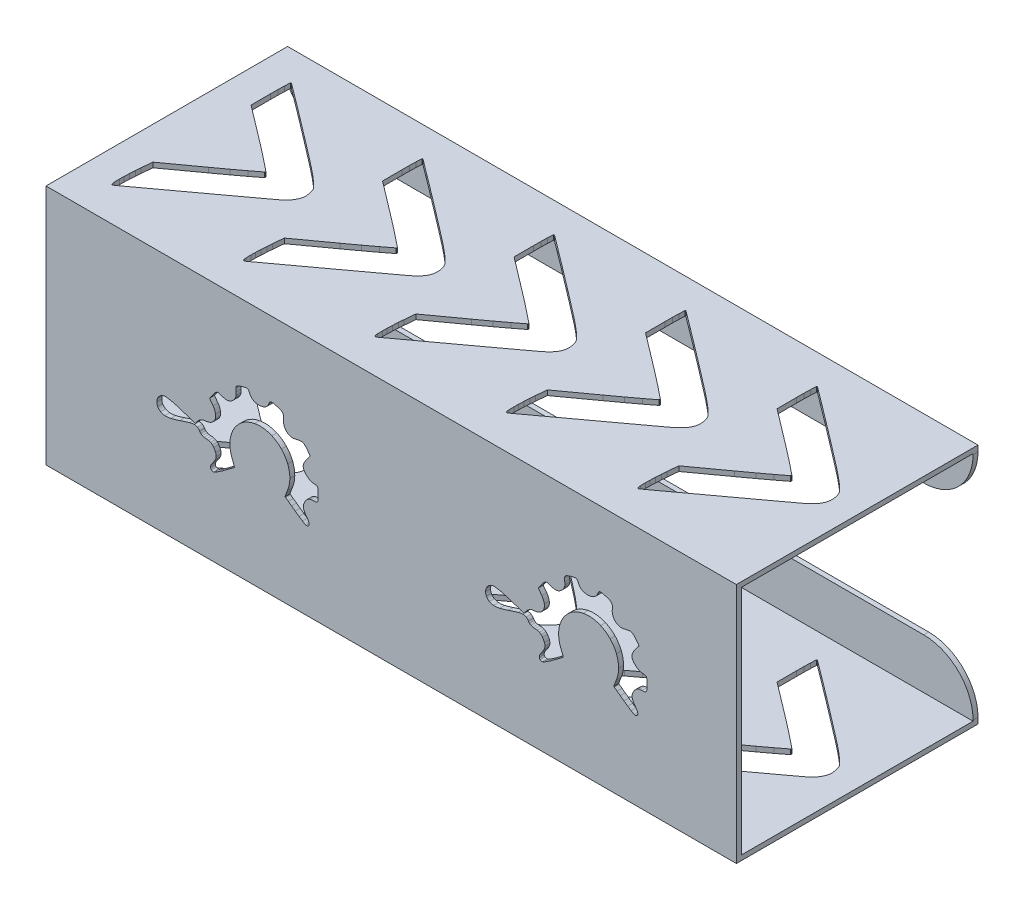
from build123d import *

# Parameters (mm, degrees)
SKETCH1_W           = 73.5
SKETCH1_H           = 73.5
BOSS_EXTRUDE1_DEPTH = 210
SHELL1_T            = -1.5
SKETCH2_W           = 210
SKETCH2_H           = 40
CUT_EXTRUDE1_DEPTH  = 72
FILLET1_R           = 15
CUT_EXTRUDE2_DEPTH  = 235.317092846
CUT_EXTRUDE3_DEPTH  = 235.317092846


with BuildPart() as part:
    # Sketch1 → Boss-Extrude1 (new body)
    with BuildSketch(Plane.YZ):
        with Locations((36.75, -36.75)):
            Rectangle(SKETCH1_W, SKETCH1_H)
    extrude(amount=BOSS_EXTRUDE1_DEPTH)

    # Shell1
    shell1_openings = [part.faces().sort_by_distance(p)[0] for p in [
        (210, 36.75, -36.75),
        (0, 36.75, -36.75),
    ]]
    offset(amount=SHELL1_T, openings=shell1_openings, kind=Kind.INTERSECTION)

    # Sketch2 → Cut-Extrude1 (cut)
    with BuildSketch(Plane(origin=(0, 0, -73.5), x_dir=(1, 0, 0), z_dir=(0, 0, -1))):
        with Locations((105, -36.75)):
            Rectangle(SKETCH2_W, SKETCH2_H)
    extrude(amount=-CUT_EXTRUDE1_DEPTH, mode=Mode.SUBTRACT)

    # Fillet1
    fillet1_edges = [part.edges().sort_by_distance(p)[0] for p in [
        (0, 56.75, -72.75),
        (0, 16.75, -72.75),
        (210, 16.75, -72.75),
        (210, 56.75, -72.75),
    ]]
    fillet(fillet1_edges, radius=FILLET1_R)

    # Sketch3 → Cut-Extrude2 (cut, through all)
    with BuildSketch(Plane.XZ):
        with BuildLine():
            Line((9.663257467, -19.228668253), (9.975836342, -22.536988138))
            Line((9.975836342, -22.536988138), (19.794289654, -29.64259699))
            ThreePointArc((19.794289654, -29.64259699), (21.680186944, -31.013445307), (23.560329366, -32.392175946))
            ThreePointArc((23.560329366, -32.392175946), (25.152200304, -33.572999566), (26.73601923, -34.764601478))
            ThreePointArc((26.73601923, -34.764601478), (28.127037125, -35.819882766), (29.516779226, -36.876843634))
            ThreePointArc((29.516779226, -36.876843634), (29.601580065, -36.975921835), (29.638093182, -37.101119538))
            ThreePointArc((29.638093182, -37.101119538), (29.616500804, -37.226977105), (29.538902118, -37.328391118))
            ThreePointArc((29.538902118, -37.328391118), (28.145149029, -38.444923087), (26.74997907, -39.55968409))
            ThreePointArc((26.74997907, -39.55968409), (25.160360253, -40.818728958), (23.561627814, -42.066180982))
            ThreePointArc((23.561627814, -42.066180982), (21.669255475, -43.524968693), (19.770389604, -44.97529385))
            Line((19.770389604, -44.97529385), (9.877794374, -52.496205334))
            Line((9.877794374, -52.496205334), (9.864618886, -58.465205334))
            ThreePointArc((9.864618886, -58.465205334), (9.866878883, -59.609623683), (9.878712838, -60.753983078))
            ThreePointArc((9.878712838, -60.753983078), (9.899425164, -61.717588304), (9.93356363, -62.68081133))
            ThreePointArc((9.93356363, -62.68081133), (9.970188655, -63.506317239), (10.010019657, -64.331674671))
            ThreePointArc((10.010019657, -64.331674671), (10.043438117, -64.404479774), (10.117827417, -64.434205327))
            ThreePointArc((10.117827417, -64.434205327), (10.220085544, -64.417623662), (10.311863958, -64.369577863))
            Line((10.311863958, -64.369577863), (14.816379874, -60.994539874))
            ThreePointArc((14.816379874, -60.994539874), (17.326887767, -59.107618199), (19.83253799, -57.214250762))
            ThreePointArc((19.83253799, -57.214250762), (22.787440363, -54.971790576), (25.738827422, -52.724705766))
            ThreePointArc((25.738827422, -52.724705766), (30.013178264, -49.453504747), (34.276329778, -46.167721674))
            ThreePointArc((34.276329778, -46.167721674), (36.389532688, -44.494924194), (38.464591658, -42.775038086))
            ThreePointArc((38.464591658, -42.775038086), (39.67538838, -41.705916753), (40.842428914, -40.589195874))
            ThreePointArc((40.842428914, -40.589195874), (41.384316671, -39.913892426), (41.763925166, -39.135705766))
            ThreePointArc((41.763925166, -39.135705766), (42.046538139, -38.092832108), (42.163637854, -37.018707714))
            ThreePointArc((42.163637854, -37.018707714), (42.091706427, -36.040632584), (41.819391654, -35.098480922))
            ThreePointArc((41.819391654, -35.098480922), (41.32598649, -34.140518072), (40.66857963, -33.286727878))
            ThreePointArc((40.66857963, -33.286727878), (39.706433503, -32.338963648), (38.660461726, -31.484607022))
            ThreePointArc((38.660461726, -31.484607022), (34.874262586, -28.679614228), (31.083552318, -25.880720846))
            ThreePointArc((31.083552318, -25.880720846), (26.166186357, -22.258918743), (21.246098192, -18.640815524))
            Line((21.246098192, -18.640815524), (10.73131159, -10.916203658))
            ThreePointArc((10.73131159, -10.916203658), (10.360052326, -10.655012395), (9.97844289, -10.409190194))
            ThreePointArc((9.97844289, -10.409190194), (9.83011461, -10.371570742), (9.686821934, -10.425270934))
            ThreePointArc((9.686821934, -10.425270934), (9.557626632, -10.566188974), (9.481675786, -10.741633522))
            ThreePointArc((9.481675786, -10.741633522), (9.407228217, -11.127679811), (9.372710265, -11.519320832))
            ThreePointArc((9.372710265, -11.519320832), (9.353024947, -12.244151425), (9.347054262, -12.969224698))
            ThreePointArc((9.347054262, -12.969224698), (9.353376442, -13.653172477), (9.370667626, -14.336930878))
            ThreePointArc((9.370667626, -14.336930878), (9.402423427, -15.181214679), (9.441426946, -16.02519471))
            ThreePointArc((9.441426946, -16.02519471), (9.488624469, -16.886465956), (9.543178838, -17.747302518))
            ThreePointArc((9.543178838, -17.747302518), (9.598284967, -18.488385266), (9.663257467, -19.228668253))
        make_face()
        with BuildLine():
            Line((49.663257467, -19.228668253), (49.975836342, -22.536988138))
            Line((49.975836342, -22.536988138), (59.794289654, -29.64259699))
            ThreePointArc((59.794289654, -29.64259699), (61.680186944, -31.013445307), (63.560329366, -32.392175946))
            ThreePointArc((63.560329366, -32.392175946), (65.152200304, -33.572999566), (66.73601923, -34.764601478))
            ThreePointArc((66.73601923, -34.764601478), (68.127037125, -35.819882766), (69.516779226, -36.876843634))
            ThreePointArc((69.516779226, -36.876843634), (69.601580065, -36.975921835), (69.638093182, -37.101119538))
            ThreePointArc((69.638093182, -37.101119538), (69.616500804, -37.226977105), (69.538902118, -37.328391118))
            ThreePointArc((69.538902118, -37.328391118), (68.145149029, -38.444923087), (66.74997907, -39.55968409))
            ThreePointArc((66.74997907, -39.55968409), (65.160360253, -40.818728958), (63.561627814, -42.066180982))
            ThreePointArc((63.561627814, -42.066180982), (61.669255475, -43.524968693), (59.770389604, -44.97529385))
            Line((59.770389604, -44.97529385), (49.877794374, -52.496205334))
            Line((49.877794374, -52.496205334), (49.864618886, -58.465205334))
            ThreePointArc((49.864618886, -58.465205334), (49.866878883, -59.609623683), (49.878712838, -60.753983078))
            ThreePointArc((49.878712838, -60.753983078), (49.899425164, -61.717588304), (49.93356363, -62.68081133))
            ThreePointArc((49.93356363, -62.68081133), (49.970188655, -63.506317239), (50.010019657, -64.331674671))
            ThreePointArc((50.010019657, -64.331674671), (50.043438117, -64.404479774), (50.117827417, -64.434205327))
            ThreePointArc((50.117827417, -64.434205327), (50.220085544, -64.417623662), (50.311863958, -64.369577863))
            Line((50.311863958, -64.369577863), (54.816379874, -60.994539874))
            ThreePointArc((54.816379874, -60.994539874), (57.326887767, -59.107618199), (59.83253799, -57.214250762))
            ThreePointArc((59.83253799, -57.214250762), (62.787440363, -54.971790576), (65.738827422, -52.724705766))
            ThreePointArc((65.738827422, -52.724705766), (70.013178264, -49.453504747), (74.276329778, -46.167721674))
            ThreePointArc((74.276329778, -46.167721674), (76.389532688, -44.494924194), (78.464591658, -42.775038086))
            ThreePointArc((78.464591658, -42.775038086), (79.67538838, -41.705916753), (80.842428914, -40.589195874))
            ThreePointArc((80.842428914, -40.589195874), (81.384316671, -39.913892426), (81.763925166, -39.135705766))
            ThreePointArc((81.763925166, -39.135705766), (82.046538139, -38.092832108), (82.163637854, -37.018707714))
            ThreePointArc((82.163637854, -37.018707714), (82.091706427, -36.040632584), (81.819391654, -35.098480922))
            ThreePointArc((81.819391654, -35.098480922), (81.32598649, -34.140518072), (80.66857963, -33.286727878))
            ThreePointArc((80.66857963, -33.286727878), (79.706433503, -32.338963648), (78.660461726, -31.484607022))
            ThreePointArc((78.660461726, -31.484607022), (74.874262586, -28.679614228), (71.083552318, -25.880720846))
            ThreePointArc((71.083552318, -25.880720846), (66.166186357, -22.258918743), (61.246098192, -18.640815524))
            Line((61.246098192, -18.640815524), (50.73131159, -10.916203658))
            ThreePointArc((50.73131159, -10.916203658), (50.360052326, -10.655012395), (49.97844289, -10.409190194))
            ThreePointArc((49.97844289, -10.409190194), (49.83011461, -10.371570742), (49.686821934, -10.425270934))
            ThreePointArc((49.686821934, -10.425270934), (49.557626632, -10.566188974), (49.481675786, -10.741633522))
            ThreePointArc((49.481675786, -10.741633522), (49.407228217, -11.127679811), (49.372710265, -11.519320832))
            ThreePointArc((49.372710265, -11.519320832), (49.353024947, -12.244151425), (49.347054262, -12.969224698))
            ThreePointArc((49.347054262, -12.969224698), (49.353376442, -13.653172477), (49.370667626, -14.336930878))
            ThreePointArc((49.370667626, -14.336930878), (49.402423427, -15.181214679), (49.441426946, -16.02519471))
            ThreePointArc((49.441426946, -16.02519471), (49.488624469, -16.886465956), (49.543178838, -17.747302518))
            ThreePointArc((49.543178838, -17.747302518), (49.598284967, -18.488385266), (49.663257467, -19.228668253))
        make_face()
        with BuildLine():
            Line((89.663257467, -19.228668253), (89.975836342, -22.536988138))
            Line((89.975836342, -22.536988138), (99.794289654, -29.64259699))
            ThreePointArc((99.794289654, -29.64259699), (101.680186944, -31.013445307), (103.560329366, -32.392175946))
            ThreePointArc((103.560329366, -32.392175946), (105.152200304, -33.572999566), (106.73601923, -34.764601478))
            ThreePointArc((106.73601923, -34.764601478), (108.127037125, -35.819882766), (109.516779226, -36.876843634))
            ThreePointArc((109.516779226, -36.876843634), (109.601580065, -36.975921835), (109.638093182, -37.101119538))
            ThreePointArc((109.638093182, -37.101119538), (109.616500804, -37.226977105), (109.538902118, -37.328391118))
            ThreePointArc((109.538902118, -37.328391118), (108.145149029, -38.444923087), (106.74997907, -39.55968409))
            ThreePointArc((106.74997907, -39.55968409), (105.160360253, -40.818728958), (103.561627814, -42.066180982))
            ThreePointArc((103.561627814, -42.066180982), (101.669255475, -43.524968693), (99.770389604, -44.97529385))
            Line((99.770389604, -44.97529385), (89.877794374, -52.496205334))
            Line((89.877794374, -52.496205334), (89.864618886, -58.465205334))
            ThreePointArc((89.864618886, -58.465205334), (89.866878883, -59.609623683), (89.878712838, -60.753983078))
            ThreePointArc((89.878712838, -60.753983078), (89.899425164, -61.717588304), (89.93356363, -62.68081133))
            ThreePointArc((89.93356363, -62.68081133), (89.970188655, -63.506317239), (90.010019657, -64.331674671))
            ThreePointArc((90.010019657, -64.331674671), (90.043438117, -64.404479774), (90.117827417, -64.434205327))
            ThreePointArc((90.117827417, -64.434205327), (90.220085544, -64.417623662), (90.311863958, -64.369577863))
            Line((90.311863958, -64.369577863), (94.816379874, -60.994539874))
            ThreePointArc((94.816379874, -60.994539874), (97.326887767, -59.107618199), (99.83253799, -57.214250762))
            ThreePointArc((99.83253799, -57.214250762), (102.787440363, -54.971790576), (105.738827422, -52.724705766))
            ThreePointArc((105.738827422, -52.724705766), (110.013178264, -49.453504747), (114.276329778, -46.167721674))
            ThreePointArc((114.276329778, -46.167721674), (116.389532688, -44.494924194), (118.464591658, -42.775038086))
            ThreePointArc((118.464591658, -42.775038086), (119.67538838, -41.705916753), (120.842428914, -40.589195874))
            ThreePointArc((120.842428914, -40.589195874), (121.384316671, -39.913892426), (121.763925166, -39.135705766))
            ThreePointArc((121.763925166, -39.135705766), (122.046538139, -38.092832108), (122.163637854, -37.018707714))
            ThreePointArc((122.163637854, -37.018707714), (122.091706427, -36.040632584), (121.819391654, -35.098480922))
            ThreePointArc((121.819391654, -35.098480922), (121.32598649, -34.140518072), (120.66857963, -33.286727878))
            ThreePointArc((120.66857963, -33.286727878), (119.706433503, -32.338963648), (118.660461726, -31.484607022))
            ThreePointArc((118.660461726, -31.484607022), (114.874262586, -28.679614228), (111.083552318, -25.880720846))
            ThreePointArc((111.083552318, -25.880720846), (106.166186357, -22.258918743), (101.246098192, -18.640815524))
            Line((101.246098192, -18.640815524), (90.73131159, -10.916203658))
            ThreePointArc((90.73131159, -10.916203658), (90.360052326, -10.655012395), (89.97844289, -10.409190194))
            ThreePointArc((89.97844289, -10.409190194), (89.83011461, -10.371570742), (89.686821934, -10.425270934))
            ThreePointArc((89.686821934, -10.425270934), (89.557626632, -10.566188974), (89.481675786, -10.741633522))
            ThreePointArc((89.481675786, -10.741633522), (89.407228217, -11.127679811), (89.372710265, -11.519320832))
            ThreePointArc((89.372710265, -11.519320832), (89.353024947, -12.244151425), (89.347054262, -12.969224698))
            ThreePointArc((89.347054262, -12.969224698), (89.353376442, -13.653172477), (89.370667626, -14.336930878))
            ThreePointArc((89.370667626, -14.336930878), (89.402423427, -15.181214679), (89.441426946, -16.02519471))
            ThreePointArc((89.441426946, -16.02519471), (89.488624469, -16.886465956), (89.543178838, -17.747302518))
            ThreePointArc((89.543178838, -17.747302518), (89.598284967, -18.488385266), (89.663257467, -19.228668253))
        make_face()
        with BuildLine():
            Line((129.663257467, -19.228668253), (129.975836342, -22.536988138))
            Line((129.975836342, -22.536988138), (139.794289654, -29.64259699))
            ThreePointArc((139.794289654, -29.64259699), (141.680186944, -31.013445307), (143.560329366, -32.392175946))
            ThreePointArc((143.560329366, -32.392175946), (145.152200304, -33.572999566), (146.73601923, -34.764601478))
            ThreePointArc((146.73601923, -34.764601478), (148.127037125, -35.819882766), (149.516779226, -36.876843634))
            ThreePointArc((149.516779226, -36.876843634), (149.601580065, -36.975921835), (149.638093182, -37.101119538))
            ThreePointArc((149.638093182, -37.101119538), (149.616500804, -37.226977105), (149.538902118, -37.328391118))
            ThreePointArc((149.538902118, -37.328391118), (148.145149029, -38.444923087), (146.74997907, -39.55968409))
            ThreePointArc((146.74997907, -39.55968409), (145.160360253, -40.818728958), (143.561627814, -42.066180982))
            ThreePointArc((143.561627814, -42.066180982), (141.669255475, -43.524968693), (139.770389604, -44.97529385))
            Line((139.770389604, -44.97529385), (129.877794374, -52.496205334))
            Line((129.877794374, -52.496205334), (129.864618886, -58.465205334))
            ThreePointArc((129.864618886, -58.465205334), (129.866878883, -59.609623683), (129.878712838, -60.753983078))
            ThreePointArc((129.878712838, -60.753983078), (129.899425164, -61.717588304), (129.93356363, -62.68081133))
            ThreePointArc((129.93356363, -62.68081133), (129.970188655, -63.506317239), (130.010019657, -64.331674671))
            ThreePointArc((130.010019657, -64.331674671), (130.043438117, -64.404479774), (130.117827417, -64.434205327))
            ThreePointArc((130.117827417, -64.434205327), (130.220085544, -64.417623662), (130.311863958, -64.369577863))
            Line((130.311863958, -64.369577863), (134.816379874, -60.994539874))
            ThreePointArc((134.816379874, -60.994539874), (137.326887767, -59.107618199), (139.83253799, -57.214250762))
            ThreePointArc((139.83253799, -57.214250762), (142.787440363, -54.971790576), (145.738827422, -52.724705766))
            ThreePointArc((145.738827422, -52.724705766), (150.013178264, -49.453504747), (154.276329778, -46.167721674))
            ThreePointArc((154.276329778, -46.167721674), (156.389532688, -44.494924194), (158.464591658, -42.775038086))
            ThreePointArc((158.464591658, -42.775038086), (159.67538838, -41.705916753), (160.842428914, -40.589195874))
            ThreePointArc((160.842428914, -40.589195874), (161.384316671, -39.913892426), (161.763925166, -39.135705766))
            ThreePointArc((161.763925166, -39.135705766), (162.046538139, -38.092832108), (162.163637854, -37.018707714))
            ThreePointArc((162.163637854, -37.018707714), (162.091706427, -36.040632584), (161.819391654, -35.098480922))
            ThreePointArc((161.819391654, -35.098480922), (161.32598649, -34.140518072), (160.66857963, -33.286727878))
            ThreePointArc((160.66857963, -33.286727878), (159.706433503, -32.338963648), (158.660461726, -31.484607022))
            ThreePointArc((158.660461726, -31.484607022), (154.874262586, -28.679614228), (151.083552318, -25.880720846))
            ThreePointArc((151.083552318, -25.880720846), (146.166186357, -22.258918743), (141.246098192, -18.640815524))
            Line((141.246098192, -18.640815524), (130.73131159, -10.916203658))
            ThreePointArc((130.73131159, -10.916203658), (130.360052326, -10.655012395), (129.97844289, -10.409190194))
            ThreePointArc((129.97844289, -10.409190194), (129.83011461, -10.371570742), (129.686821934, -10.425270934))
            ThreePointArc((129.686821934, -10.425270934), (129.557626632, -10.566188974), (129.481675786, -10.741633522))
            ThreePointArc((129.481675786, -10.741633522), (129.407228217, -11.127679811), (129.372710265, -11.519320832))
            ThreePointArc((129.372710265, -11.519320832), (129.353024947, -12.244151425), (129.347054262, -12.969224698))
            ThreePointArc((129.347054262, -12.969224698), (129.353376442, -13.653172477), (129.370667626, -14.336930878))
            ThreePointArc((129.370667626, -14.336930878), (129.402423427, -15.181214679), (129.441426946, -16.02519471))
            ThreePointArc((129.441426946, -16.02519471), (129.488624469, -16.886465956), (129.543178838, -17.747302518))
            ThreePointArc((129.543178838, -17.747302518), (129.598284967, -18.488385266), (129.663257467, -19.228668253))
        make_face()
        with BuildLine():
            Line((169.663257467, -19.228668253), (169.975836342, -22.536988138))
            Line((169.975836342, -22.536988138), (179.794289654, -29.64259699))
            ThreePointArc((179.794289654, -29.64259699), (181.680186944, -31.013445307), (183.560329366, -32.392175946))
            ThreePointArc((183.560329366, -32.392175946), (185.152200304, -33.572999566), (186.73601923, -34.764601478))
            ThreePointArc((186.73601923, -34.764601478), (188.127037125, -35.819882766), (189.516779226, -36.876843634))
            ThreePointArc((189.516779226, -36.876843634), (189.601580065, -36.975921835), (189.638093182, -37.101119538))
            ThreePointArc((189.638093182, -37.101119538), (189.616500804, -37.226977105), (189.538902118, -37.328391118))
            ThreePointArc((189.538902118, -37.328391118), (188.145149029, -38.444923087), (186.74997907, -39.55968409))
            ThreePointArc((186.74997907, -39.55968409), (185.160360253, -40.818728958), (183.561627814, -42.066180982))
            ThreePointArc((183.561627814, -42.066180982), (181.669255475, -43.524968693), (179.770389604, -44.97529385))
            Line((179.770389604, -44.97529385), (169.877794374, -52.496205334))
            Line((169.877794374, -52.496205334), (169.864618886, -58.465205334))
            ThreePointArc((169.864618886, -58.465205334), (169.866878883, -59.609623683), (169.878712838, -60.753983078))
            ThreePointArc((169.878712838, -60.753983078), (169.899425164, -61.717588304), (169.93356363, -62.68081133))
            ThreePointArc((169.93356363, -62.68081133), (169.970188655, -63.506317239), (170.010019657, -64.331674671))
            ThreePointArc((170.010019657, -64.331674671), (170.043438117, -64.404479774), (170.117827417, -64.434205327))
            ThreePointArc((170.117827417, -64.434205327), (170.220085544, -64.417623662), (170.311863958, -64.369577863))
            Line((170.311863958, -64.369577863), (174.816379874, -60.994539874))
            ThreePointArc((174.816379874, -60.994539874), (177.326887767, -59.107618199), (179.83253799, -57.214250762))
            ThreePointArc((179.83253799, -57.214250762), (182.787440363, -54.971790576), (185.738827422, -52.724705766))
            ThreePointArc((185.738827422, -52.724705766), (190.013178264, -49.453504747), (194.276329778, -46.167721674))
            ThreePointArc((194.276329778, -46.167721674), (196.389532688, -44.494924194), (198.464591658, -42.775038086))
            ThreePointArc((198.464591658, -42.775038086), (199.67538838, -41.705916753), (200.842428914, -40.589195874))
            ThreePointArc((200.842428914, -40.589195874), (201.384316671, -39.913892426), (201.763925166, -39.135705766))
            ThreePointArc((201.763925166, -39.135705766), (202.046538139, -38.092832108), (202.163637854, -37.018707714))
            ThreePointArc((202.163637854, -37.018707714), (202.091706427, -36.040632584), (201.819391654, -35.098480922))
            ThreePointArc((201.819391654, -35.098480922), (201.32598649, -34.140518072), (200.66857963, -33.286727878))
            ThreePointArc((200.66857963, -33.286727878), (199.706433503, -32.338963648), (198.660461726, -31.484607022))
            ThreePointArc((198.660461726, -31.484607022), (194.874262586, -28.679614228), (191.083552318, -25.880720846))
            ThreePointArc((191.083552318, -25.880720846), (186.166186357, -22.258918743), (181.246098192, -18.640815524))
            Line((181.246098192, -18.640815524), (170.73131159, -10.916203658))
            ThreePointArc((170.73131159, -10.916203658), (170.360052326, -10.655012395), (169.97844289, -10.409190194))
            ThreePointArc((169.97844289, -10.409190194), (169.83011461, -10.371570742), (169.686821934, -10.425270934))
            ThreePointArc((169.686821934, -10.425270934), (169.557626632, -10.566188974), (169.481675786, -10.741633522))
            ThreePointArc((169.481675786, -10.741633522), (169.407228217, -11.127679811), (169.372710265, -11.519320832))
            ThreePointArc((169.372710265, -11.519320832), (169.353024947, -12.244151425), (169.347054262, -12.969224698))
            ThreePointArc((169.347054262, -12.969224698), (169.353376442, -13.653172477), (169.370667626, -14.336930878))
            ThreePointArc((169.370667626, -14.336930878), (169.402423427, -15.181214679), (169.441426946, -16.02519471))
            ThreePointArc((169.441426946, -16.02519471), (169.488624469, -16.886465956), (169.543178838, -17.747302518))
            ThreePointArc((169.543178838, -17.747302518), (169.598284967, -18.488385266), (169.663257467, -19.228668253))
        make_face()
    extrude(amount=-CUT_EXTRUDE2_DEPTH, mode=Mode.SUBTRACT)

    # Sketch7 → Cut-Extrude3 (cut, through all)
    with BuildSketch(Plane(origin=(0, 0, 0), x_dir=(-1, 0, 0), z_dir=(0, 0, 1))):
        with BuildLine():
            Line((-179.321663234, -41.14088793), (-180.406501868, -42.520035924))
            Line((-180.406501868, -42.520035924), (-179.377241544, -43.876391352))
            ThreePointArc((-179.377241544, -43.876391352), (-179.030776284, -44.298503593), (-178.653140376, -44.692975444))
            ThreePointArc((-178.653140376, -44.692975444), (-178.373869296, -44.896663015), (-178.049447908, -45.015959812))
            ThreePointArc((-178.049447908, -45.015959812), (-177.64930214, -45.062445672), (-177.247753804, -45.030250868))
            ThreePointArc((-177.247753804, -45.030250868), (-176.431305736, -44.871857402), (-175.619535064, -44.691014056))
            ThreePointArc((-175.619535064, -44.691014056), (-174.951483062, -44.624789984), (-174.28978258, -44.73806654))
            ThreePointArc((-174.28978258, -44.73806654), (-173.659117444, -45.024360836), (-173.11665564, -45.454986112))
            ThreePointArc((-173.11665564, -45.454986112), (-172.676458207, -46.021218643), (-172.379019828, -46.673846768))
            ThreePointArc((-172.379019828, -46.673846768), (-172.23775788, -47.382184055), (-172.260532892, -48.104110608))
            ThreePointArc((-172.260532892, -48.104110608), (-172.298158921, -48.614976609), (-172.261870964, -49.1259394))
            ThreePointArc((-172.261870964, -49.1259394), (-172.145170809, -49.492101984), (-171.915853876, -49.80049736))
            ThreePointArc((-171.915853876, -49.80049736), (-171.539809671, -50.089980039), (-171.10968226, -50.290479108))
            ThreePointArc((-171.10968226, -50.290479108), (-170.314322929, -50.539378064), (-169.508370248, -50.751480472))
            ThreePointArc((-169.508370248, -50.751480472), (-169.155085532, -50.823211001), (-168.797739208, -50.870739568))
            ThreePointArc((-168.797739208, -50.870739568), (-168.570451639, -50.864574921), (-168.351792424, -50.802238816))
            ThreePointArc((-168.351792424, -50.802238816), (-168.178939432, -50.694531215), (-168.046943656, -50.539430604))
            ThreePointArc((-168.046943656, -50.539430604), (-167.914562339, -50.291229489), (-167.813308868, -50.028786464))
            ThreePointArc((-167.813308868, -50.028786464), (-167.413552129, -49.272079461), (-166.774345236, -48.703022796))
            ThreePointArc((-166.774345236, -48.703022796), (-165.89579108, -48.308819341), (-164.946386992, -48.147929164))
            ThreePointArc((-164.946386992, -48.147929164), (-163.99424549, -48.231400994), (-163.09450398, -48.55390092))
            ThreePointArc((-163.09450398, -48.55390092), (-162.425551912, -49.06909097), (-161.986344652, -49.790211376))
            ThreePointArc((-161.986344652, -49.790211376), (-161.842429133, -50.12629544), (-161.67129626, -50.44937084))
            ThreePointArc((-161.67129626, -50.44937084), (-161.529159296, -50.619826597), (-161.339074928, -50.734395416))
            ThreePointArc((-161.339074928, -50.734395416), (-161.104159512, -50.791209612), (-160.862661352, -50.781631288))
            ThreePointArc((-160.862661352, -50.781631288), (-160.423186432, -50.690985625), (-159.988858172, -50.57823012))
            ThreePointArc((-159.988858172, -50.57823012), (-159.263615434, -50.356933764), (-158.546245868, -50.11131208))
            ThreePointArc((-158.546245868, -50.11131208), (-158.225531321, -49.947675985), (-157.955295056, -49.709753828))
            ThreePointArc((-157.955295056, -49.709753828), (-157.793338193, -49.444438529), (-157.73266304, -49.13957666))
            ThreePointArc((-157.73266304, -49.13957666), (-157.743582629, -48.618128784), (-157.797795752, -48.099391796))
            ThreePointArc((-157.797795752, -48.099391796), (-157.834085938, -47.724472779), (-157.833343052, -47.34780224))
            ThreePointArc((-157.833343052, -47.34780224), (-157.79290114, -47.015345334), (-157.706563016, -46.691757832))
            ThreePointArc((-157.706563016, -46.691757832), (-157.574572741, -46.378754676), (-157.401085344, -46.0867024))
            ThreePointArc((-157.401085344, -46.0867024), (-157.164795796, -45.775697666), (-156.90137946, -45.48730812))
            ThreePointArc((-156.90137946, -45.48730812), (-156.50785057, -45.147273763), (-156.069154048, -44.867928612))
            ThreePointArc((-156.069154048, -44.867928612), (-155.645411476, -44.694722751), (-155.194680308, -44.614726172))
            ThreePointArc((-155.194680308, -44.614726172), (-154.667320837, -44.622724803), (-154.14884496, -44.719444784))
            ThreePointArc((-154.14884496, -44.719444784), (-153.450246306, -44.936932481), (-152.767381632, -45.19968106))
            ThreePointArc((-152.767381632, -45.19968106), (-152.550284586, -45.259486296), (-152.325105148, -45.260905728))
            ThreePointArc((-152.325105148, -45.260905728), (-152.090222101, -45.205422966), (-151.872482228, -45.101318544))
            ThreePointArc((-151.872482228, -45.101318544), (-151.614763794, -44.915462652), (-151.38629016, -44.694643716))
            ThreePointArc((-151.38629016, -44.694643716), (-151.102196964, -44.359184204), (-150.837302265, -44.008366835))
            Line((-150.837302265, -44.008366835), (-149.738653628, -42.465456912))
            Line((-149.738653628, -42.465456912), (-150.8111732, -41.014796872))
            ThreePointArc((-150.8111732, -41.014796872), (-151.297962451, -40.166639094), (-151.577441416, -39.229501484))
            ThreePointArc((-151.577441416, -39.229501484), (-151.591472145, -38.351362841), (-151.331492708, -37.512473676))
            ThreePointArc((-151.331492708, -37.512473676), (-150.825298047, -36.801244644), (-150.121303104, -36.285036456))
            ThreePointArc((-150.121303104, -36.285036456), (-149.213717078, -35.948907246), (-148.252643392, -35.83474678))
            ThreePointArc((-148.252643392, -35.83474678), (-148.007727184, -35.814899021), (-147.769202652, -35.755874192))
            ThreePointArc((-147.769202652, -35.755874192), (-147.489500491, -35.647905142), (-147.220620056, -35.51526304))
            ThreePointArc((-147.220620056, -35.51526304), (-146.950104223, -35.350683443), (-146.694850724, -35.163304384))
            ThreePointArc((-146.694850724, -35.163304384), (-146.474797857, -34.96638826), (-146.276985268, -34.747140902))
            Line((-146.276985268, -34.747140902), (-145.396298584, -33.659538024))
            Line((-145.396298584, -33.659538024), (-141.21969378, -35.050475044))
            ThreePointArc((-141.21969378, -35.050475044), (-140.313656804, -35.340049355), (-139.400860232, -35.60755394))
            ThreePointArc((-139.400860232, -35.60755394), (-138.616256284, -35.810750314), (-137.824314744, -35.983147296))
            ThreePointArc((-137.824314744, -35.983147296), (-137.190742508, -36.093999256), (-136.552973624, -36.17738262))
            ThreePointArc((-136.552973624, -36.17738262), (-136.163458011, -36.185106029), (-135.778677484, -36.124064972))
            ThreePointArc((-135.778677484, -36.124064972), (-135.222677367, -35.915581029), (-134.727428888, -35.587967492))
            ThreePointArc((-134.727428888, -35.587967492), (-134.305584812, -35.151126578), (-133.984685136, -34.635562996))
            ThreePointArc((-133.984685136, -34.635562996), (-133.785521525, -34.076622475), (-133.711786012, -33.4878579))
            ThreePointArc((-133.711786012, -33.4878579), (-133.774229316, -32.927863497), (-133.975155056, -32.401439956))
            ThreePointArc((-133.975155056, -32.401439956), (-134.354221473, -31.878675628), (-134.859788288, -31.476959204))
            ThreePointArc((-134.859788288, -31.476959204), (-135.476174387, -31.205114337), (-136.13952868, -31.087672708))
            ThreePointArc((-136.13952868, -31.087672708), (-137.069837646, -31.104178948), (-137.987879568, -31.255659164))
            ThreePointArc((-137.987879568, -31.255659164), (-139.33592604, -31.613229815), (-140.666224732, -32.032027436))
            ThreePointArc((-140.666224732, -32.032027436), (-142.129356617, -32.514166999), (-143.601410596, -32.968337178))
            ThreePointArc((-143.601410596, -32.968337178), (-144.354648103, -33.142676748), (-145.12371032, -33.222076574))
            ThreePointArc((-145.12371032, -33.222076574), (-145.609158337, -33.172108568), (-146.060730036, -32.98706917))
            ThreePointArc((-146.060730036, -32.98706917), (-146.449539983, -32.679730661), (-146.740817576, -32.278747498))
            ThreePointArc((-146.740817576, -32.278747498), (-146.888434914, -32.048587385), (-147.07038156, -31.844479634))
            ThreePointArc((-147.07038156, -31.844479634), (-147.285457349, -31.667208024), (-147.524469044, -31.52383359))
            ThreePointArc((-147.524469044, -31.52383359), (-147.802501934, -31.406842559), (-148.093753656, -31.328346554))
            ThreePointArc((-148.093753656, -31.328346554), (-148.426213212, -31.279186483), (-148.761885416, -31.262747498))
            ThreePointArc((-148.761885416, -31.262747498), (-149.104425315, -31.244220548), (-149.442968636, -31.18885585))
            ThreePointArc((-149.442968636, -31.18885585), (-149.759008037, -31.098808087), (-150.061628816, -30.970705918))
            ThreePointArc((-150.061628816, -30.970705918), (-150.340177074, -30.809429542), (-150.59626732, -30.61445009))
            ThreePointArc((-150.59626732, -30.61445009), (-150.82794629, -30.387441604), (-151.030011944, -30.13371445))
            ThreePointArc((-151.030011944, -30.13371445), (-151.352755861, -29.611947847), (-151.613988932, -29.056825062))
            ThreePointArc((-151.613988932, -29.056825062), (-151.744976464, -28.586248857), (-151.76884562, -28.098365714))
            ThreePointArc((-151.76884562, -28.098365714), (-151.684539035, -27.598219932), (-151.49822132, -27.126479418))
            ThreePointArc((-151.49822132, -27.126479418), (-151.161141853, -26.54743872), (-150.771805196, -26.002161118))
            ThreePointArc((-150.771805196, -26.002161118), (-150.460663883, -25.561754374), (-150.196406804, -25.091716914))
            ThreePointArc((-150.196406804, -25.091716914), (-150.069650473, -24.722031309), (-150.042505156, -24.332162426))
            ThreePointArc((-150.042505156, -24.332162426), (-150.121889054, -24.056419416), (-150.31091356, -23.840535774))
            ThreePointArc((-150.31091356, -23.840535774), (-150.597513215, -23.693450639), (-150.91563676, -23.642747498))
            ThreePointArc((-150.91563676, -23.642747498), (-151.093680104, -23.66608754), (-151.259691444, -23.734530398))
            ThreePointArc((-151.259691444, -23.734530398), (-151.704468574, -23.995205217), (-152.144627952, -24.263603762))
            ThreePointArc((-152.144627952, -24.263603762), (-152.669454186, -24.598833402), (-153.186003568, -24.94668139))
            ThreePointArc((-153.186003568, -24.94668139), (-153.750430306, -25.344087543), (-154.307862412, -25.751246773))
            Line((-154.307862412, -25.751246773), (-155.412927771, -26.573234689))
            Line((-155.412927771, -26.573234689), (-156.359785923, -27.276742045))
            Line((-156.359785923, -27.276742045), (-157.186206927, -27.890226721))
            ThreePointArc((-157.186206927, -27.890226721), (-157.237130479, -27.92756315), (-157.288486631, -27.964302265))
            ThreePointArc((-157.288486631, -27.964302265), (-157.318856704, -28.00481079), (-157.319800259, -28.055430861))
            ThreePointArc((-157.319800259, -28.055430861), (-157.239963839, -28.313900067), (-157.157093447, -28.571412557))
            ThreePointArc((-157.157093447, -28.571412557), (-157.051543805, -28.88021028), (-156.938533051, -29.186356209))
            ThreePointArc((-156.938533051, -29.186356209), (-156.798682262, -29.543463885), (-156.653486631, -29.898432001))
            ThreePointArc((-156.653486631, -29.898432001), (-155.980759026, -32.553929173), (-156.110055155, -35.290260689))
            ThreePointArc((-156.110055155, -35.290260689), (-157.02964926, -37.878846906), (-158.657532407, -40.091634373))
            ThreePointArc((-158.657532407, -40.091634373), (-160.8371487, -41.71908898), (-163.397987239, -42.636390269))
            ThreePointArc((-163.397987239, -42.636390269), (-166.089654917, -42.750397892), (-168.690720875, -42.048594137))
            ThreePointArc((-168.690720875, -42.048594137), (-170.244502811, -41.171718628), (-171.599344471, -40.010877105))
            ThreePointArc((-171.599344471, -40.010877105), (-172.706377125, -38.608259589), (-173.522614691, -37.018727133))
            ThreePointArc((-173.522614691, -37.018727133), (-174.018467074, -35.299527883), (-174.174599671, -33.517075005))
            ThreePointArc((-174.174599671, -33.517075005), (-173.985308479, -31.73718094), (-173.457766967, -30.026755849))
            ThreePointArc((-173.457766967, -30.026755849), (-173.302285272, -29.647150101), (-173.152159755, -29.265394405))
            ThreePointArc((-173.152159755, -29.265394405), (-173.030486826, -28.93842692), (-172.916292815, -28.608772909))
            ThreePointArc((-172.916292815, -28.608772909), (-172.825743196, -28.332637261), (-172.738075747, -28.055573101))
            ThreePointArc((-172.738075747, -28.055573101), (-172.738668473, -28.004342376), (-172.769149599, -27.963161805))
            ThreePointArc((-172.769149599, -27.963161805), (-172.820880431, -27.926003358), (-172.872453892, -27.888626798))
            Line((-172.872453892, -27.888626798), (-173.715224928, -27.275131692))
            Line((-173.715224928, -27.275131692), (-174.68118134, -26.571742192))
            Line((-174.68118134, -26.571742192), (-175.80212652, -25.75516064))
            ThreePointArc((-175.80212652, -25.75516064), (-176.372572608, -25.34615842), (-176.949188488, -24.9459014))
            ThreePointArc((-176.949188488, -24.9459014), (-177.469192929, -24.598941634), (-177.996553424, -24.263268272))
            ThreePointArc((-177.996553424, -24.263268272), (-178.439642357, -23.992281994), (-178.886570948, -23.727676252))
            ThreePointArc((-178.886570948, -23.727676252), (-179.038226913, -23.664352681), (-179.201145884, -23.64274678))
            ThreePointArc((-179.201145884, -23.64274678), (-179.502725296, -23.694947567), (-179.769213836, -23.845476372))
            ThreePointArc((-179.769213836, -23.845476372), (-179.946080245, -24.067401792), (-180.015798052, -24.342487316))
            ThreePointArc((-180.015798052, -24.342487316), (-179.981271707, -24.734093411), (-179.85181362, -25.10529148))
            ThreePointArc((-179.85181362, -25.10529148), (-179.592064418, -25.568393393), (-179.2858305, -26.0021604))
            ThreePointArc((-179.2858305, -26.0021604), (-178.896493843, -26.547438003), (-178.559414376, -27.1264787))
            ThreePointArc((-178.559414376, -27.1264787), (-178.373096662, -27.598219214), (-178.288790076, -28.098364996))
            ThreePointArc((-178.288790076, -28.098364996), (-178.312659233, -28.586248139), (-178.443646764, -29.056824344))
            ThreePointArc((-178.443646764, -29.056824344), (-178.704879836, -29.611947129), (-179.027623752, -30.133713732))
            ThreePointArc((-179.027623752, -30.133713732), (-179.230724407, -30.388730599), (-179.46359748, -30.6168832))
            ThreePointArc((-179.46359748, -30.6168832), (-179.720147834, -30.811873632), (-179.999399304, -30.972677764))
            ThreePointArc((-179.999399304, -30.972677764), (-180.303986772, -31.100334951), (-180.622002072, -31.189420028))
            ThreePointArc((-180.622002072, -31.189420028), (-180.965874776, -31.244364003), (-181.313623752, -31.26274678))
            ThreePointArc((-181.313623752, -31.26274678), (-181.760842754, -31.279778063), (-182.205471092, -31.330773568))
            ThreePointArc((-182.205471092, -31.330773568), (-182.429066517, -31.415468381), (-182.598751992, -31.58391708))
            ThreePointArc((-182.598751992, -31.58391708), (-182.722424943, -31.842171863), (-182.774074984, -32.123814908))
            ThreePointArc((-182.774074984, -32.123814908), (-182.8001308, -32.836069102), (-182.80881812, -33.54874678))
            ThreePointArc((-182.80881812, -33.54874678), (-182.800171423, -34.229657654), (-182.774236528, -34.910129376))
            ThreePointArc((-182.774236528, -34.910129376), (-182.725346818, -35.203974371), (-182.611262508, -35.47914678))
            ThreePointArc((-182.611262508, -35.47914678), (-182.460909076, -35.652513293), (-182.253451977, -35.750613519))
            ThreePointArc((-182.253451977, -35.750613519), (-181.898602759, -35.813641053), (-181.53881812, -35.83474678))
            ThreePointArc((-181.53881812, -35.83474678), (-180.968292282, -35.898224945), (-180.425671756, -36.085554))
            ThreePointArc((-180.425671756, -36.085554), (-179.849820086, -36.412171281), (-179.327382868, -36.818795612))
            ThreePointArc((-179.327382868, -36.818795612), (-178.883531887, -37.283871019), (-178.513790388, -37.809789312))
            ThreePointArc((-178.513790388, -37.809789312), (-178.307329668, -38.293270177), (-178.23681812, -38.814238408))
            ThreePointArc((-178.23681812, -38.814238408), (-178.255464783, -39.046656081), (-178.3109277, -39.273128016))
            ThreePointArc((-178.3109277, -39.273128016), (-178.4242778, -39.584378799), (-178.555490584, -39.8885309))
            ThreePointArc((-178.555490584, -39.8885309), (-178.721845692, -40.220790567), (-178.906465752, -40.54325908))
            ThreePointArc((-178.906465752, -40.54325908), (-179.105197704, -40.84823363), (-179.321663234, -41.14088793))
        make_face()
        with BuildLine():
            Line((-79.321663234, -41.14088793), (-80.406501868, -42.520035924))
            Line((-80.406501868, -42.520035924), (-79.377241544, -43.876391352))
            ThreePointArc((-79.377241544, -43.876391352), (-79.030776284, -44.298503593), (-78.653140376, -44.692975444))
            ThreePointArc((-78.653140376, -44.692975444), (-78.373869296, -44.896663015), (-78.049447908, -45.015959812))
            ThreePointArc((-78.049447908, -45.015959812), (-77.64930214, -45.062445672), (-77.247753804, -45.030250868))
            ThreePointArc((-77.247753804, -45.030250868), (-76.431305736, -44.871857402), (-75.619535064, -44.691014056))
            ThreePointArc((-75.619535064, -44.691014056), (-74.951483062, -44.624789984), (-74.28978258, -44.73806654))
            ThreePointArc((-74.28978258, -44.73806654), (-73.659117444, -45.024360836), (-73.11665564, -45.454986112))
            ThreePointArc((-73.11665564, -45.454986112), (-72.676458207, -46.021218643), (-72.379019828, -46.673846768))
            ThreePointArc((-72.379019828, -46.673846768), (-72.23775788, -47.382184055), (-72.260532892, -48.104110608))
            ThreePointArc((-72.260532892, -48.104110608), (-72.298158921, -48.614976609), (-72.261870964, -49.1259394))
            ThreePointArc((-72.261870964, -49.1259394), (-72.145170809, -49.492101984), (-71.915853876, -49.80049736))
            ThreePointArc((-71.915853876, -49.80049736), (-71.539809671, -50.089980039), (-71.10968226, -50.290479108))
            ThreePointArc((-71.10968226, -50.290479108), (-70.314322929, -50.539378064), (-69.508370248, -50.751480472))
            ThreePointArc((-69.508370248, -50.751480472), (-69.155085532, -50.823211001), (-68.797739208, -50.870739568))
            ThreePointArc((-68.797739208, -50.870739568), (-68.570451639, -50.864574921), (-68.351792424, -50.802238816))
            ThreePointArc((-68.351792424, -50.802238816), (-68.178939432, -50.694531215), (-68.046943656, -50.539430604))
            ThreePointArc((-68.046943656, -50.539430604), (-67.914562339, -50.291229489), (-67.813308868, -50.028786464))
            ThreePointArc((-67.813308868, -50.028786464), (-67.413552129, -49.272079461), (-66.774345236, -48.703022796))
            ThreePointArc((-66.774345236, -48.703022796), (-65.89579108, -48.308819341), (-64.946386992, -48.147929164))
            ThreePointArc((-64.946386992, -48.147929164), (-63.99424549, -48.231400994), (-63.09450398, -48.55390092))
            ThreePointArc((-63.09450398, -48.55390092), (-62.425551912, -49.06909097), (-61.986344652, -49.790211376))
            ThreePointArc((-61.986344652, -49.790211376), (-61.842429133, -50.12629544), (-61.67129626, -50.44937084))
            ThreePointArc((-61.67129626, -50.44937084), (-61.529159296, -50.619826597), (-61.339074928, -50.734395416))
            ThreePointArc((-61.339074928, -50.734395416), (-61.104159512, -50.791209612), (-60.862661352, -50.781631288))
            ThreePointArc((-60.862661352, -50.781631288), (-60.423186432, -50.690985625), (-59.988858172, -50.57823012))
            ThreePointArc((-59.988858172, -50.57823012), (-59.263615434, -50.356933764), (-58.546245868, -50.11131208))
            ThreePointArc((-58.546245868, -50.11131208), (-58.225531321, -49.947675985), (-57.955295056, -49.709753828))
            ThreePointArc((-57.955295056, -49.709753828), (-57.793338193, -49.444438529), (-57.73266304, -49.13957666))
            ThreePointArc((-57.73266304, -49.13957666), (-57.743582629, -48.618128784), (-57.797795752, -48.099391796))
            ThreePointArc((-57.797795752, -48.099391796), (-57.834085938, -47.724472779), (-57.833343052, -47.34780224))
            ThreePointArc((-57.833343052, -47.34780224), (-57.79290114, -47.015345334), (-57.706563016, -46.691757832))
            ThreePointArc((-57.706563016, -46.691757832), (-57.574572741, -46.378754676), (-57.401085344, -46.0867024))
            ThreePointArc((-57.401085344, -46.0867024), (-57.164795796, -45.775697666), (-56.90137946, -45.48730812))
            ThreePointArc((-56.90137946, -45.48730812), (-56.50785057, -45.147273763), (-56.069154048, -44.867928612))
            ThreePointArc((-56.069154048, -44.867928612), (-55.645411476, -44.694722751), (-55.194680308, -44.614726172))
            ThreePointArc((-55.194680308, -44.614726172), (-54.667320837, -44.622724803), (-54.14884496, -44.719444784))
            ThreePointArc((-54.14884496, -44.719444784), (-53.450246306, -44.936932481), (-52.767381632, -45.19968106))
            ThreePointArc((-52.767381632, -45.19968106), (-52.550284586, -45.259486296), (-52.325105148, -45.260905728))
            ThreePointArc((-52.325105148, -45.260905728), (-52.090222101, -45.205422966), (-51.872482228, -45.101318544))
            ThreePointArc((-51.872482228, -45.101318544), (-51.614763794, -44.915462652), (-51.38629016, -44.694643716))
            ThreePointArc((-51.38629016, -44.694643716), (-51.102196964, -44.359184204), (-50.837302265, -44.008366835))
            Line((-50.837302265, -44.008366835), (-49.738653628, -42.465456912))
            Line((-49.738653628, -42.465456912), (-50.8111732, -41.014796872))
            ThreePointArc((-50.8111732, -41.014796872), (-51.297962451, -40.166639094), (-51.577441416, -39.229501484))
            ThreePointArc((-51.577441416, -39.229501484), (-51.591472145, -38.351362841), (-51.331492708, -37.512473676))
            ThreePointArc((-51.331492708, -37.512473676), (-50.825298047, -36.801244644), (-50.121303104, -36.285036456))
            ThreePointArc((-50.121303104, -36.285036456), (-49.213717078, -35.948907246), (-48.252643392, -35.83474678))
            ThreePointArc((-48.252643392, -35.83474678), (-48.007727184, -35.814899021), (-47.769202652, -35.755874192))
            ThreePointArc((-47.769202652, -35.755874192), (-47.489500491, -35.647905142), (-47.220620056, -35.51526304))
            ThreePointArc((-47.220620056, -35.51526304), (-46.950104223, -35.350683443), (-46.694850724, -35.163304384))
            ThreePointArc((-46.694850724, -35.163304384), (-46.474797857, -34.96638826), (-46.276985268, -34.747140902))
            Line((-46.276985268, -34.747140902), (-45.396298584, -33.659538024))
            Line((-45.396298584, -33.659538024), (-41.21969378, -35.050475044))
            ThreePointArc((-41.21969378, -35.050475044), (-40.313656804, -35.340049355), (-39.400860232, -35.60755394))
            ThreePointArc((-39.400860232, -35.60755394), (-38.616256284, -35.810750314), (-37.824314744, -35.983147296))
            ThreePointArc((-37.824314744, -35.983147296), (-37.190742508, -36.093999256), (-36.552973624, -36.17738262))
            ThreePointArc((-36.552973624, -36.17738262), (-36.163458011, -36.185106029), (-35.778677484, -36.124064972))
            ThreePointArc((-35.778677484, -36.124064972), (-35.222677367, -35.915581029), (-34.727428888, -35.587967492))
            ThreePointArc((-34.727428888, -35.587967492), (-34.305584812, -35.151126578), (-33.984685136, -34.635562996))
            ThreePointArc((-33.984685136, -34.635562996), (-33.785521525, -34.076622475), (-33.711786012, -33.4878579))
            ThreePointArc((-33.711786012, -33.4878579), (-33.774229316, -32.927863497), (-33.975155056, -32.401439956))
            ThreePointArc((-33.975155056, -32.401439956), (-34.354221473, -31.878675628), (-34.859788288, -31.476959204))
            ThreePointArc((-34.859788288, -31.476959204), (-35.476174387, -31.205114337), (-36.13952868, -31.087672708))
            ThreePointArc((-36.13952868, -31.087672708), (-37.069837646, -31.104178948), (-37.987879568, -31.255659164))
            ThreePointArc((-37.987879568, -31.255659164), (-39.33592604, -31.613229815), (-40.666224732, -32.032027436))
            ThreePointArc((-40.666224732, -32.032027436), (-42.129356617, -32.514166999), (-43.601410596, -32.968337178))
            ThreePointArc((-43.601410596, -32.968337178), (-44.354648103, -33.142676748), (-45.12371032, -33.222076574))
            ThreePointArc((-45.12371032, -33.222076574), (-45.609158337, -33.172108568), (-46.060730036, -32.98706917))
            ThreePointArc((-46.060730036, -32.98706917), (-46.449539983, -32.679730661), (-46.740817576, -32.278747498))
            ThreePointArc((-46.740817576, -32.278747498), (-46.888434914, -32.048587385), (-47.07038156, -31.844479634))
            ThreePointArc((-47.07038156, -31.844479634), (-47.285457349, -31.667208024), (-47.524469044, -31.52383359))
            ThreePointArc((-47.524469044, -31.52383359), (-47.802501934, -31.406842559), (-48.093753656, -31.328346554))
            ThreePointArc((-48.093753656, -31.328346554), (-48.426213212, -31.279186483), (-48.761885416, -31.262747498))
            ThreePointArc((-48.761885416, -31.262747498), (-49.104425315, -31.244220548), (-49.442968636, -31.18885585))
            ThreePointArc((-49.442968636, -31.18885585), (-49.759008037, -31.098808087), (-50.061628816, -30.970705918))
            ThreePointArc((-50.061628816, -30.970705918), (-50.340177074, -30.809429542), (-50.59626732, -30.61445009))
            ThreePointArc((-50.59626732, -30.61445009), (-50.82794629, -30.387441604), (-51.030011944, -30.13371445))
            ThreePointArc((-51.030011944, -30.13371445), (-51.352755861, -29.611947847), (-51.613988932, -29.056825062))
            ThreePointArc((-51.613988932, -29.056825062), (-51.744976464, -28.586248857), (-51.76884562, -28.098365714))
            ThreePointArc((-51.76884562, -28.098365714), (-51.684539035, -27.598219932), (-51.49822132, -27.126479418))
            ThreePointArc((-51.49822132, -27.126479418), (-51.161141853, -26.54743872), (-50.771805196, -26.002161118))
            ThreePointArc((-50.771805196, -26.002161118), (-50.460663883, -25.561754374), (-50.196406804, -25.091716914))
            ThreePointArc((-50.196406804, -25.091716914), (-50.069650473, -24.722031309), (-50.042505156, -24.332162426))
            ThreePointArc((-50.042505156, -24.332162426), (-50.121889054, -24.056419416), (-50.31091356, -23.840535774))
            ThreePointArc((-50.31091356, -23.840535774), (-50.597513215, -23.693450639), (-50.91563676, -23.642747498))
            ThreePointArc((-50.91563676, -23.642747498), (-51.093680104, -23.66608754), (-51.259691444, -23.734530398))
            ThreePointArc((-51.259691444, -23.734530398), (-51.704468574, -23.995205217), (-52.144627952, -24.263603762))
            ThreePointArc((-52.144627952, -24.263603762), (-52.669454186, -24.598833402), (-53.186003568, -24.94668139))
            ThreePointArc((-53.186003568, -24.94668139), (-53.750430306, -25.344087543), (-54.307862412, -25.751246773))
            Line((-54.307862412, -25.751246773), (-55.412927771, -26.573234689))
            Line((-55.412927771, -26.573234689), (-56.359785923, -27.276742045))
            Line((-56.359785923, -27.276742045), (-57.186206927, -27.890226721))
            ThreePointArc((-57.186206927, -27.890226721), (-57.237130479, -27.92756315), (-57.288486631, -27.964302265))
            ThreePointArc((-57.288486631, -27.964302265), (-57.318856704, -28.00481079), (-57.319800259, -28.055430861))
            ThreePointArc((-57.319800259, -28.055430861), (-57.239963839, -28.313900067), (-57.157093447, -28.571412557))
            ThreePointArc((-57.157093447, -28.571412557), (-57.051543805, -28.88021028), (-56.938533051, -29.186356209))
            ThreePointArc((-56.938533051, -29.186356209), (-56.798682262, -29.543463885), (-56.653486631, -29.898432001))
            ThreePointArc((-56.653486631, -29.898432001), (-55.980759026, -32.553929173), (-56.110055155, -35.290260689))
            ThreePointArc((-56.110055155, -35.290260689), (-57.02964926, -37.878846906), (-58.657532407, -40.091634373))
            ThreePointArc((-58.657532407, -40.091634373), (-60.8371487, -41.71908898), (-63.397987239, -42.636390269))
            ThreePointArc((-63.397987239, -42.636390269), (-66.089654917, -42.750397892), (-68.690720875, -42.048594137))
            ThreePointArc((-68.690720875, -42.048594137), (-70.244502811, -41.171718628), (-71.599344471, -40.010877105))
            ThreePointArc((-71.599344471, -40.010877105), (-72.706377125, -38.608259589), (-73.522614691, -37.018727133))
            ThreePointArc((-73.522614691, -37.018727133), (-74.018467074, -35.299527883), (-74.174599671, -33.517075005))
            ThreePointArc((-74.174599671, -33.517075005), (-73.985308479, -31.73718094), (-73.457766967, -30.026755849))
            ThreePointArc((-73.457766967, -30.026755849), (-73.302285272, -29.647150101), (-73.152159755, -29.265394405))
            ThreePointArc((-73.152159755, -29.265394405), (-73.030486826, -28.93842692), (-72.916292815, -28.608772909))
            ThreePointArc((-72.916292815, -28.608772909), (-72.825743196, -28.332637261), (-72.738075747, -28.055573101))
            ThreePointArc((-72.738075747, -28.055573101), (-72.738668473, -28.004342376), (-72.769149599, -27.963161805))
            ThreePointArc((-72.769149599, -27.963161805), (-72.820880431, -27.926003358), (-72.872453892, -27.888626798))
            Line((-72.872453892, -27.888626798), (-73.715224928, -27.275131692))
            Line((-73.715224928, -27.275131692), (-74.68118134, -26.571742192))
            Line((-74.68118134, -26.571742192), (-75.80212652, -25.75516064))
            ThreePointArc((-75.80212652, -25.75516064), (-76.372572608, -25.34615842), (-76.949188488, -24.9459014))
            ThreePointArc((-76.949188488, -24.9459014), (-77.469192929, -24.598941634), (-77.996553424, -24.263268272))
            ThreePointArc((-77.996553424, -24.263268272), (-78.439642357, -23.992281994), (-78.886570948, -23.727676252))
            ThreePointArc((-78.886570948, -23.727676252), (-79.038226913, -23.664352681), (-79.201145884, -23.64274678))
            ThreePointArc((-79.201145884, -23.64274678), (-79.502725296, -23.694947567), (-79.769213836, -23.845476372))
            ThreePointArc((-79.769213836, -23.845476372), (-79.946080245, -24.067401792), (-80.015798052, -24.342487316))
            ThreePointArc((-80.015798052, -24.342487316), (-79.981271707, -24.734093411), (-79.85181362, -25.10529148))
            ThreePointArc((-79.85181362, -25.10529148), (-79.592064418, -25.568393393), (-79.2858305, -26.0021604))
            ThreePointArc((-79.2858305, -26.0021604), (-78.896493843, -26.547438003), (-78.559414376, -27.1264787))
            ThreePointArc((-78.559414376, -27.1264787), (-78.373096662, -27.598219214), (-78.288790076, -28.098364996))
            ThreePointArc((-78.288790076, -28.098364996), (-78.312659233, -28.586248139), (-78.443646764, -29.056824344))
            ThreePointArc((-78.443646764, -29.056824344), (-78.704879836, -29.611947129), (-79.027623752, -30.133713732))
            ThreePointArc((-79.027623752, -30.133713732), (-79.230724407, -30.388730599), (-79.46359748, -30.6168832))
            ThreePointArc((-79.46359748, -30.6168832), (-79.720147834, -30.811873632), (-79.999399304, -30.972677764))
            ThreePointArc((-79.999399304, -30.972677764), (-80.303986772, -31.100334951), (-80.622002072, -31.189420028))
            ThreePointArc((-80.622002072, -31.189420028), (-80.965874776, -31.244364003), (-81.313623752, -31.26274678))
            ThreePointArc((-81.313623752, -31.26274678), (-81.760842754, -31.279778063), (-82.205471092, -31.330773568))
            ThreePointArc((-82.205471092, -31.330773568), (-82.429066517, -31.415468381), (-82.598751992, -31.58391708))
            ThreePointArc((-82.598751992, -31.58391708), (-82.722424943, -31.842171863), (-82.774074984, -32.123814908))
            ThreePointArc((-82.774074984, -32.123814908), (-82.8001308, -32.836069102), (-82.80881812, -33.54874678))
            ThreePointArc((-82.80881812, -33.54874678), (-82.800171423, -34.229657654), (-82.774236528, -34.910129376))
            ThreePointArc((-82.774236528, -34.910129376), (-82.725346818, -35.203974371), (-82.611262508, -35.47914678))
            ThreePointArc((-82.611262508, -35.47914678), (-82.460909076, -35.652513293), (-82.253451977, -35.750613519))
            ThreePointArc((-82.253451977, -35.750613519), (-81.898602759, -35.813641053), (-81.53881812, -35.83474678))
            ThreePointArc((-81.53881812, -35.83474678), (-80.968292282, -35.898224945), (-80.425671756, -36.085554))
            ThreePointArc((-80.425671756, -36.085554), (-79.849820086, -36.412171281), (-79.327382868, -36.818795612))
            ThreePointArc((-79.327382868, -36.818795612), (-78.883531887, -37.283871019), (-78.513790388, -37.809789312))
            ThreePointArc((-78.513790388, -37.809789312), (-78.307329668, -38.293270177), (-78.23681812, -38.814238408))
            ThreePointArc((-78.23681812, -38.814238408), (-78.255464783, -39.046656081), (-78.3109277, -39.273128016))
            ThreePointArc((-78.3109277, -39.273128016), (-78.4242778, -39.584378799), (-78.555490584, -39.8885309))
            ThreePointArc((-78.555490584, -39.8885309), (-78.721845692, -40.220790567), (-78.906465752, -40.54325908))
            ThreePointArc((-78.906465752, -40.54325908), (-79.105197704, -40.84823363), (-79.321663234, -41.14088793))
        make_face()
    extrude(amount=-CUT_EXTRUDE3_DEPTH, mode=Mode.SUBTRACT)


solid = part.part
